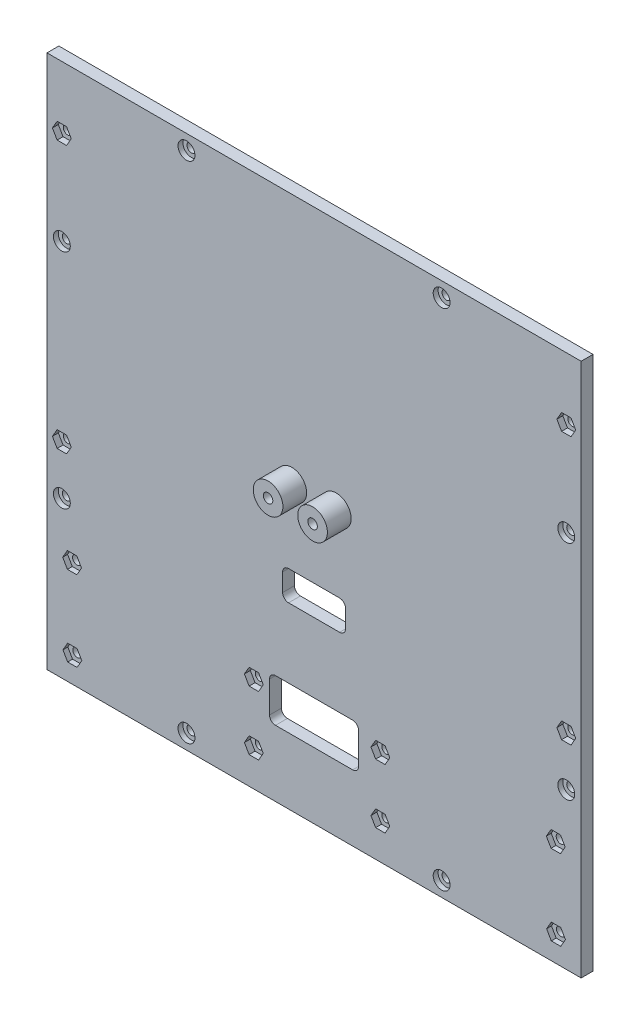
from build123d import *

# Parameters (mm, degrees)
CROQUIS1_W              = 180
CROQUIS1_H              = 180
SALIENTE_EXTRUIR1_DEPTH = 4
CORTAR_EXTRUIR7_REACH   = 271.715
CROQUIS14_R             = 1.5
CROQUIS15_R             = 2.85
CORTAR_EXTRUIR8_DEPTH   = 1.65
CROQUIS16_R             = 1.5
CORTAR_EXTRUIR9_DEPTH   = 2
CORTAR_EXTRUIR10_REACH  = 271.715
CROQUIS17_R             = 1.5
CORTAR_EXTRUIR12_REACH  = 271.715
CROQUIS19_R             = 1.5
CORTAR_EXTRUIR13_DEPTH  = 1.65
CORTAR_EXTRUIR14_REACH  = 271.715
CROQUIS21_R             = 1.5
CORTAR_EXTRUIR15_DEPTH  = 2
CROQUIS23_R             = 5
CROQUIS23_R_2           = 1.6
SALIENTE_EXTRUIR2_DEPTH = 8
CORTAR_EXTRUIR16_START  = 2
CORTAR_EXTRUIR16_DEPTH  = 2.7
CROQUIS23_5_W           = 21.2
CROQUIS23_5_H           = 10
CORTAR_EXTRUIR17_DEPTH  = 5
REDONDEO1_R             = 2
CORTAR_EXTRUIR18_REACH  = 271.804


with BuildPart() as part:
    # Croquis1 → Saliente-Extruir1 (new body)
    with BuildSketch(Plane.XY):
        with Locations((-4, 162.773389683)):
            Rectangle(CROQUIS1_W, CROQUIS1_H)
    extrude(amount=SALIENTE_EXTRUIR1_DEPTH)

    # Croquis14 → Cortar-Extruir7 (cut, up to next)
    with BuildSketch(Plane.XY.offset(4), mode=Mode.PRIVATE) as cortar_extruir7_sk1:
        with Locations((-89, 200.273389683)):
            Circle(CROQUIS14_R)
    cortar_extruir7_tool1 = extrude(cortar_extruir7_sk1.sketch, amount=-CORTAR_EXTRUIR7_REACH, mode=Mode.PRIVATE) & part.part
    # Croquis14 → Cortar-Extruir7 (cut, up to next)
    with BuildSketch(Plane.XY.offset(4), mode=Mode.PRIVATE) as cortar_extruir7_sk2:
        with Locations((-89, 125.273389683)):
            Circle(CROQUIS14_R)
    cortar_extruir7_tool2 = extrude(cortar_extruir7_sk2.sketch, amount=-CORTAR_EXTRUIR7_REACH, mode=Mode.PRIVATE) & part.part
    # Croquis14 → Cortar-Extruir7 (cut, up to next)
    with BuildSketch(Plane.XY.offset(4), mode=Mode.PRIVATE) as cortar_extruir7_sk3:
        with Locations((-46.991549296, 247.773389683)):
            Circle(CROQUIS14_R)
    cortar_extruir7_tool3 = extrude(cortar_extruir7_sk3.sketch, amount=-CORTAR_EXTRUIR7_REACH, mode=Mode.PRIVATE) & part.part
    # Croquis14 → Cortar-Extruir7 (cut, up to next)
    with BuildSketch(Plane.XY.offset(4), mode=Mode.PRIVATE) as cortar_extruir7_sk4:
        with Locations((38.991549296, 247.773389683)):
            Circle(CROQUIS14_R)
    cortar_extruir7_tool4 = extrude(cortar_extruir7_sk4.sketch, amount=-CORTAR_EXTRUIR7_REACH, mode=Mode.PRIVATE) & part.part
    # Croquis14 → Cortar-Extruir7 (cut, up to next)
    with BuildSketch(Plane.XY.offset(4), mode=Mode.PRIVATE) as cortar_extruir7_sk5:
        with Locations((81, 200.273389683)):
            Circle(CROQUIS14_R)
    cortar_extruir7_tool5 = extrude(cortar_extruir7_sk5.sketch, amount=-CORTAR_EXTRUIR7_REACH, mode=Mode.PRIVATE) & part.part
    # Croquis14 → Cortar-Extruir7 (cut, up to next)
    with BuildSketch(Plane.XY.offset(4), mode=Mode.PRIVATE) as cortar_extruir7_sk6:
        with Locations((81, 125.273389683)):
            Circle(CROQUIS14_R)
    cortar_extruir7_tool6 = extrude(cortar_extruir7_sk6.sketch, amount=-CORTAR_EXTRUIR7_REACH, mode=Mode.PRIVATE) & part.part
    # Croquis14 → Cortar-Extruir7 (cut, up to next)
    with BuildSketch(Plane.XY.offset(4), mode=Mode.PRIVATE) as cortar_extruir7_sk7:
        with Locations((-46.991549296, 77.773389683)):
            Circle(CROQUIS14_R)
    cortar_extruir7_tool7 = extrude(cortar_extruir7_sk7.sketch, amount=-CORTAR_EXTRUIR7_REACH, mode=Mode.PRIVATE) & part.part
    # Croquis14 → Cortar-Extruir7 (cut, up to next)
    with BuildSketch(Plane.XY.offset(4), mode=Mode.PRIVATE) as cortar_extruir7_sk8:
        with Locations((38.991549296, 77.773389683)):
            Circle(CROQUIS14_R)
    cortar_extruir7_tool8 = extrude(cortar_extruir7_sk8.sketch, amount=-CORTAR_EXTRUIR7_REACH, mode=Mode.PRIVATE) & part.part
    add(cortar_extruir7_tool1.solids().sort_by_distance((-89, 200.27339, 4))[0], mode=Mode.SUBTRACT)
    add(cortar_extruir7_tool2.solids().sort_by_distance((-89, 125.27339, 4))[0], mode=Mode.SUBTRACT)
    add(cortar_extruir7_tool3.solids().sort_by_distance((-46.991549, 247.77339, 4))[0], mode=Mode.SUBTRACT)
    add(cortar_extruir7_tool4.solids().sort_by_distance((38.991549, 247.77339, 4))[0], mode=Mode.SUBTRACT)
    add(cortar_extruir7_tool5.solids().sort_by_distance((81, 200.27339, 4))[0], mode=Mode.SUBTRACT)
    add(cortar_extruir7_tool6.solids().sort_by_distance((81, 125.27339, 4))[0], mode=Mode.SUBTRACT)
    add(cortar_extruir7_tool7.solids().sort_by_distance((-46.991549, 77.77339, 4))[0], mode=Mode.SUBTRACT)
    add(cortar_extruir7_tool8.solids().sort_by_distance((38.991549, 77.77339, 4))[0], mode=Mode.SUBTRACT)

    # Croquis15 → Cortar-Extruir8 (cut)
    with BuildSketch(Plane.XY.offset(4)):
        with Locations((-46.991549296, 77.773389683)):
            Circle(CROQUIS15_R)
        with Locations((-89, 125.273389683)):
            Circle(CROQUIS15_R)
        with Locations((-89, 200.273389683)):
            Circle(CROQUIS15_R)
        with Locations((-46.991549296, 247.773389683)):
            Circle(CROQUIS15_R)
        with Locations((38.991549296, 247.773389683)):
            Circle(CROQUIS15_R)
        with Locations((81, 200.273389683)):
            Circle(CROQUIS15_R)
        with Locations((81, 125.273389683)):
            Circle(CROQUIS15_R)
        with Locations((38.991549296, 77.773389683)):
            Circle(CROQUIS15_R)
    extrude(amount=-CORTAR_EXTRUIR8_DEPTH, mode=Mode.SUBTRACT)

    # Croquis16 → Cortar-Extruir9 (cut)
    # profile 1 of 4: a face of its own
    with BuildSketch(Plane.XY.offset(4)):
        Polygon((19.92771324, 82.023389683), (21.515426481, 84.773389683), (19.92771324, 87.523389683), (16.75228676, 87.523389683), (15.164573519, 84.773389683), (16.75228676, 82.023389683), align=None)
        with Locations((18.34, 84.773389683)):
            Circle(CROQUIS16_R, mode=Mode.SUBTRACT)
    # profile 2 of 4: a face of its own
    with BuildSketch(Plane.XY.offset(4)):
        Polygon((-22.71228676, 82.023389683), (-21.124573519, 84.773389683), (-22.71228676, 87.523389683), (-25.88771324, 87.523389683), (-27.475426481, 84.773389683), (-25.88771324, 82.023389683), align=None)
        with Locations((-24.3, 84.773389683)):
            Circle(CROQUIS16_R, mode=Mode.SUBTRACT)
    # profile 3 of 4: a face of its own
    with BuildSketch(Plane.XY.offset(4)):
        Polygon((-22.71228676, 102.0256337), (-21.124573519, 104.7756337), (-22.71228676, 107.5256337), (-25.88771324, 107.5256337), (-27.475426481, 104.7756337), (-25.88771324, 102.0256337), align=None)
        with Locations((-24.3, 104.7756337)):
            Circle(CROQUIS16_R, mode=Mode.SUBTRACT)
    # profile 4 of 4: a face of its own
    with BuildSketch(Plane.XY.offset(4)):
        Polygon((19.92771324, 102.0256337), (21.515426481, 104.7756337), (19.92771324, 107.5256337), (16.75228676, 107.5256337), (15.164573519, 104.7756337), (16.75228676, 102.0256337), align=None)
        with Locations((18.34, 104.7756337)):
            Circle(CROQUIS16_R, mode=Mode.SUBTRACT)
    extrude(amount=-CORTAR_EXTRUIR9_DEPTH, mode=Mode.SUBTRACT)

    # Croquis17 → Cortar-Extruir10 (cut, up to next)
    with BuildSketch(Plane.XY.offset(4), mode=Mode.PRIVATE) as cortar_extruir10_sk1:
        with Locations((18.34, 104.7756337)):
            Circle(CROQUIS17_R)
    cortar_extruir10_tool1 = extrude(cortar_extruir10_sk1.sketch, amount=-CORTAR_EXTRUIR10_REACH, mode=Mode.PRIVATE) & part.part
    # Croquis17 → Cortar-Extruir10 (cut, up to next)
    with BuildSketch(Plane.XY.offset(4), mode=Mode.PRIVATE) as cortar_extruir10_sk2:
        with Locations((18.34, 84.773389683)):
            Circle(CROQUIS17_R)
    cortar_extruir10_tool2 = extrude(cortar_extruir10_sk2.sketch, amount=-CORTAR_EXTRUIR10_REACH, mode=Mode.PRIVATE) & part.part
    # Croquis17 → Cortar-Extruir10 (cut, up to next)
    with BuildSketch(Plane.XY.offset(4), mode=Mode.PRIVATE) as cortar_extruir10_sk3:
        with Locations((-24.3, 84.773389683)):
            Circle(CROQUIS17_R)
    cortar_extruir10_tool3 = extrude(cortar_extruir10_sk3.sketch, amount=-CORTAR_EXTRUIR10_REACH, mode=Mode.PRIVATE) & part.part
    # Croquis17 → Cortar-Extruir10 (cut, up to next)
    with BuildSketch(Plane.XY.offset(4), mode=Mode.PRIVATE) as cortar_extruir10_sk4:
        with Locations((-24.3, 104.7756337)):
            Circle(CROQUIS17_R)
    cortar_extruir10_tool4 = extrude(cortar_extruir10_sk4.sketch, amount=-CORTAR_EXTRUIR10_REACH, mode=Mode.PRIVATE) & part.part
    add(cortar_extruir10_tool1.solids().sort_by_distance((18.34, 104.775634, 4))[0], mode=Mode.SUBTRACT)
    add(cortar_extruir10_tool2.solids().sort_by_distance((18.34, 84.77339, 4))[0], mode=Mode.SUBTRACT)
    add(cortar_extruir10_tool3.solids().sort_by_distance((-24.3, 84.77339, 4))[0], mode=Mode.SUBTRACT)
    add(cortar_extruir10_tool4.solids().sort_by_distance((-24.3, 104.775634, 4))[0], mode=Mode.SUBTRACT)

    # Croquis19 → Cortar-Extruir12 (cut, up to next)
    with BuildSketch(Plane.XY.offset(4), mode=Mode.PRIVATE) as cortar_extruir12_sk1:
        with Locations((-85.53574181, 108.2256337)):
            Circle(CROQUIS19_R)
    cortar_extruir12_tool1 = extrude(cortar_extruir12_sk1.sketch, amount=-CORTAR_EXTRUIR12_REACH, mode=Mode.PRIVATE) & part.part
    # Croquis19 → Cortar-Extruir12 (cut, up to next)
    with BuildSketch(Plane.XY.offset(4), mode=Mode.PRIVATE) as cortar_extruir12_sk2:
        with Locations((-85.45, 81.237647874)):
            Circle(CROQUIS19_R)
    cortar_extruir12_tool2 = extrude(cortar_extruir12_sk2.sketch, amount=-CORTAR_EXTRUIR12_REACH, mode=Mode.PRIVATE) & part.part
    # Croquis19 → Cortar-Extruir12 (cut, up to next)
    with BuildSketch(Plane.XY.offset(4), mode=Mode.PRIVATE) as cortar_extruir12_sk3:
        with Locations((77.45, 108.31137551)):
            Circle(CROQUIS19_R)
    cortar_extruir12_tool3 = extrude(cortar_extruir12_sk3.sketch, amount=-CORTAR_EXTRUIR12_REACH, mode=Mode.PRIVATE) & part.part
    # Croquis19 → Cortar-Extruir12 (cut, up to next)
    with BuildSketch(Plane.XY.offset(4), mode=Mode.PRIVATE) as cortar_extruir12_sk4:
        with Locations((77.535741809, 81.323389683)):
            Circle(CROQUIS19_R)
    cortar_extruir12_tool4 = extrude(cortar_extruir12_sk4.sketch, amount=-CORTAR_EXTRUIR12_REACH, mode=Mode.PRIVATE) & part.part
    add(cortar_extruir12_tool1.solids().sort_by_distance((-85.535742, 108.225634, 4))[0], mode=Mode.SUBTRACT)
    add(cortar_extruir12_tool2.solids().sort_by_distance((-85.45, 81.237648, 4))[0], mode=Mode.SUBTRACT)
    add(cortar_extruir12_tool3.solids().sort_by_distance((77.45, 108.311376, 4))[0], mode=Mode.SUBTRACT)
    add(cortar_extruir12_tool4.solids().sort_by_distance((77.535742, 81.32339, 4))[0], mode=Mode.SUBTRACT)

    # Croquis20 → Cortar-Extruir13 (cut)
    with BuildSketch(Plane.XY.offset(4)):
        Polygon((-83.86228676, 78.487647874), (-82.274573519, 81.237647874), (-83.86228676, 83.987647874), (-87.03771324, 83.987647874), (-88.625426481, 81.237647874), (-87.03771324, 78.487647874), align=None)
        Polygon((-87.12345505, 105.4756337), (-83.948028569, 105.4756337), (-82.360315329, 108.2256337), (-83.948028569, 110.9756337), (-87.12345505, 110.9756337), (-88.71116829, 108.2256337), align=None)
        Polygon((79.12345505, 78.573389683), (80.71116829, 81.323389683), (79.12345505, 84.073389683), (75.948028569, 84.073389683), (74.360315329, 81.323389683), (75.948028569, 78.573389683), align=None)
        Polygon((79.03771324, 105.56137551), (80.625426481, 108.31137551), (79.03771324, 111.06137551), (75.86228676, 111.06137551), (74.274573519, 108.31137551), (75.86228676, 105.56137551), align=None)
    extrude(amount=-CORTAR_EXTRUIR13_DEPTH, mode=Mode.SUBTRACT)

    # Croquis21 → Cortar-Extruir14 (cut, up to next)
    with BuildSketch(Plane.XY.offset(4), mode=Mode.PRIVATE) as cortar_extruir14_sk1:
        with Locations((81, 231.7756337)):
            Circle(CROQUIS21_R)
    cortar_extruir14_tool1 = extrude(cortar_extruir14_sk1.sketch, amount=-CORTAR_EXTRUIR14_REACH, mode=Mode.PRIVATE) & part.part
    # Croquis21 → Cortar-Extruir14 (cut, up to next)
    with BuildSketch(Plane.XY.offset(4), mode=Mode.PRIVATE) as cortar_extruir14_sk2:
        with Locations((-89, 231.7756337)):
            Circle(CROQUIS21_R)
    cortar_extruir14_tool2 = extrude(cortar_extruir14_sk2.sketch, amount=-CORTAR_EXTRUIR14_REACH, mode=Mode.PRIVATE) & part.part
    # Croquis21 → Cortar-Extruir14 (cut, up to next)
    with BuildSketch(Plane.XY.offset(4), mode=Mode.PRIVATE) as cortar_extruir14_sk3:
        with Locations((81, 141.7756337)):
            Circle(CROQUIS21_R)
    cortar_extruir14_tool3 = extrude(cortar_extruir14_sk3.sketch, amount=-CORTAR_EXTRUIR14_REACH, mode=Mode.PRIVATE) & part.part
    # Croquis21 → Cortar-Extruir14 (cut, up to next)
    with BuildSketch(Plane.XY.offset(4), mode=Mode.PRIVATE) as cortar_extruir14_sk4:
        with Locations((-89, 141.7756337)):
            Circle(CROQUIS21_R)
    cortar_extruir14_tool4 = extrude(cortar_extruir14_sk4.sketch, amount=-CORTAR_EXTRUIR14_REACH, mode=Mode.PRIVATE) & part.part
    add(cortar_extruir14_tool1.solids().sort_by_distance((81, 231.775634, 4))[0], mode=Mode.SUBTRACT)
    add(cortar_extruir14_tool2.solids().sort_by_distance((-89, 231.775634, 4))[0], mode=Mode.SUBTRACT)
    add(cortar_extruir14_tool3.solids().sort_by_distance((81, 141.775634, 4))[0], mode=Mode.SUBTRACT)
    add(cortar_extruir14_tool4.solids().sort_by_distance((-89, 141.775634, 4))[0], mode=Mode.SUBTRACT)

    # Croquis22 → Cortar-Extruir15 (cut)
    with BuildSketch(Plane.XY.offset(4)):
        Polygon((82.58771324, 139.0256337), (84.175426481, 141.7756337), (82.58771324, 144.5256337), (79.41228676, 144.5256337), (77.824573519, 141.7756337), (79.41228676, 139.0256337), align=None)
        Polygon((-87.41228676, 139.0256337), (-85.824573519, 141.7756337), (-87.41228676, 144.5256337), (-90.58771324, 144.5256337), (-92.175426481, 141.7756337), (-90.58771324, 139.0256337), align=None)
        Polygon((-87.41228676, 229.0256337), (-85.824573519, 231.7756337), (-87.41228676, 234.5256337), (-90.58771324, 234.5256337), (-92.175426481, 231.7756337), (-90.58771324, 229.0256337), align=None)
        Polygon((82.58771324, 229.0256337), (84.175426481, 231.7756337), (82.58771324, 234.5256337), (79.41228676, 234.5256337), (77.824573519, 231.7756337), (79.41228676, 229.0256337), align=None)
    extrude(amount=-CORTAR_EXTRUIR15_DEPTH, mode=Mode.SUBTRACT)

    # Croquis23 → Saliente-Extruir2 (add)
    # profile 1 of 2: a face of its own
    with BuildSketch(Plane.XY.offset(4)):
        with Locations((-11.5, 168.073389683)):
            Circle(CROQUIS23_R)
        with Locations((-11.5, 168.073389683)):
            Circle(CROQUIS23_R_2, mode=Mode.SUBTRACT)
    # profile 2 of 2: a face of its own
    with BuildSketch(Plane.XY.offset(4)):
        with Locations((3.5, 168.073389683)):
            Circle(CROQUIS23_R)
        with Locations((3.5, 168.073389683)):
            Circle(CROQUIS23_R_2, mode=Mode.SUBTRACT)
    extrude(amount=SALIENTE_EXTRUIR2_DEPTH)

    # Croquis23<4> → Cortar-Extruir16 (cut)
    with BuildSketch(Plane.XY.offset(4).offset(CORTAR_EXTRUIR16_START)):
        Polygon((-11.5, 171.537491298), (-14.5, 169.805440491), (-14.5, 166.341338876), (-11.5, 164.609288068), (-8.5, 166.341338876), (-8.5, 169.805440491), align=None)
        Polygon((3.5, 171.537491298), (0.5, 169.805440491), (0.5, 166.341338876), (3.5, 164.609288068), (6.5, 166.341338876), (6.5, 169.805440491), align=None)
    extrude(amount=CORTAR_EXTRUIR16_DEPTH, mode=Mode.SUBTRACT)

    # Croquis23<5> → Cortar-Extruir17 (cut)
    with BuildSketch(Plane.XY.offset(4)):
        with Locations((-4, 137.973389683)):
            Rectangle(CROQUIS23_5_W, CROQUIS23_5_H)
    extrude(amount=-CORTAR_EXTRUIR17_DEPTH, mode=Mode.SUBTRACT)

    # Redondeo1
    redondeo1_edges = [part.edges().sort_by_distance(p)[0] for p in [
        (-14.6, 132.973389683, 2),
        (6.6, 132.973389683, 2),
        (6.6, 142.973389683, 2),
        (-14.6, 142.973389683, 2),
    ]]
    fillet(redondeo1_edges, radius=REDONDEO1_R)

    # Croquis18 → Cortar-Extruir18 (cut, up to next)
    with BuildSketch(Plane.XY.offset(4), mode=Mode.PRIVATE) as cortar_extruir18_sk1:
        with BuildLine():
            Line((9, 95.0256337), (-17, 95.0256337))
            ThreePointArc((-17, 95.0256337), (-18.414213562, 95.611420138), (-19, 97.0256337))
            Line((-19, 97.0256337), (-19, 107.5256337))
            ThreePointArc((-19, 107.5256337), (-18.414213562, 108.939847263), (-17, 109.5256337))
            Line((-17, 109.5256337), (9, 109.5256337))
            ThreePointArc((9, 109.5256337), (10.414213562, 108.939847263), (11, 107.5256337))
            Line((11, 107.5256337), (11, 97.0256337))
            ThreePointArc((11, 97.0256337), (10.414213562, 95.611420138), (9, 95.0256337))
        make_face()
    cortar_extruir18_tool1 = extrude(cortar_extruir18_sk1.sketch, amount=-CORTAR_EXTRUIR18_REACH, mode=Mode.PRIVATE) & part.part
    add(cortar_extruir18_tool1.solids().sort_by_distance((-4, 102.275634, 4))[0], mode=Mode.SUBTRACT)


solid = part.part
